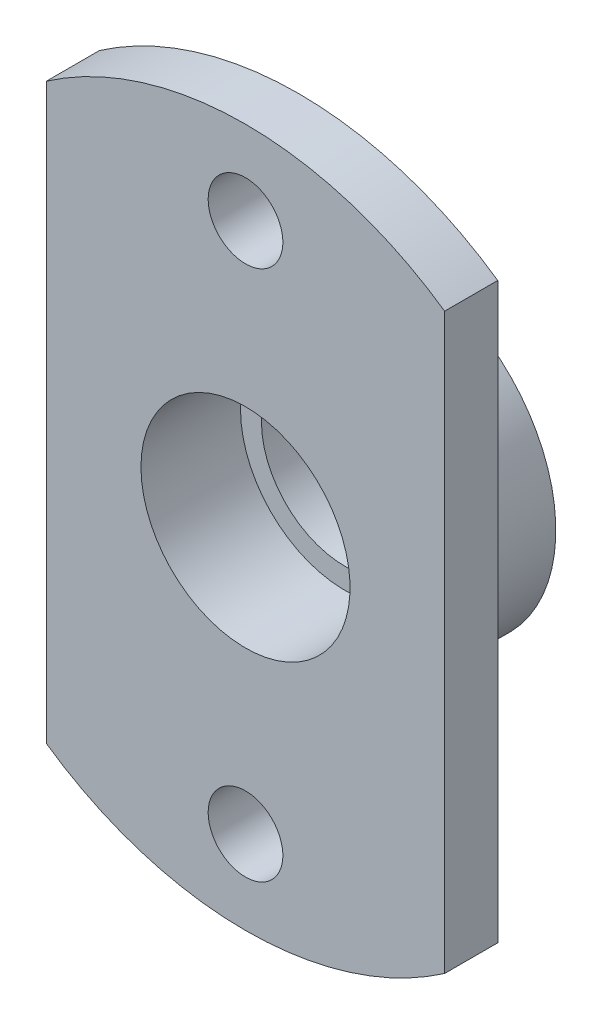
from build123d import *

# Parameters (mm, degrees)
SKETCH2_R          = 1.7859375
SKETCH2_W          = 25.4
SKETCH2_H          = 31.75
CUT_EXTRUDE1_DEPTH = 7.3025


with BuildPart() as part:
    # Sketch1 → Revolve1 (revolve)
    with BuildSketch(Plane(origin=(0, 0, 0), x_dir=(1, 0, 0), z_dir=(0, 1, 0)), mode=Mode.PRIVATE) as revolve1_sk:
        Polygon((0, 0), (-11.7, 0), (-11.7, 4.7625), (-12.7, 4.7625), (-12.7, 7.3025), (-9.16, 7.3025), (-9.16, 2.54), (0, 2.54), align=None)
    revolve(revolve1_sk.sketch.rotate(Axis((-16.7, 0, -8.744517985), (0, 0, 1)), 180), axis=Axis((-16.7, 0, -8.744517985), (0, 0, 1)))

    # Sketch2 → Cut-Extrude1 (cut)
    with BuildSketch(Plane(origin=(0, 0, -7.3025), x_dir=(-1, 0, 0), z_dir=(0, 0, -1))):
        with Locations((16.7, -12.7)):
            Circle(SKETCH2_R)
        with Locations((16.7, 12.7)):
            Circle(SKETCH2_R)
        with Locations((38.925, 0)):
            Rectangle(SKETCH2_W, SKETCH2_H)
        with Locations((-5.525, 0)):
            Rectangle(SKETCH2_W, SKETCH2_H)
    extrude(amount=-CUT_EXTRUDE1_DEPTH, mode=Mode.SUBTRACT)


solid = part.part
